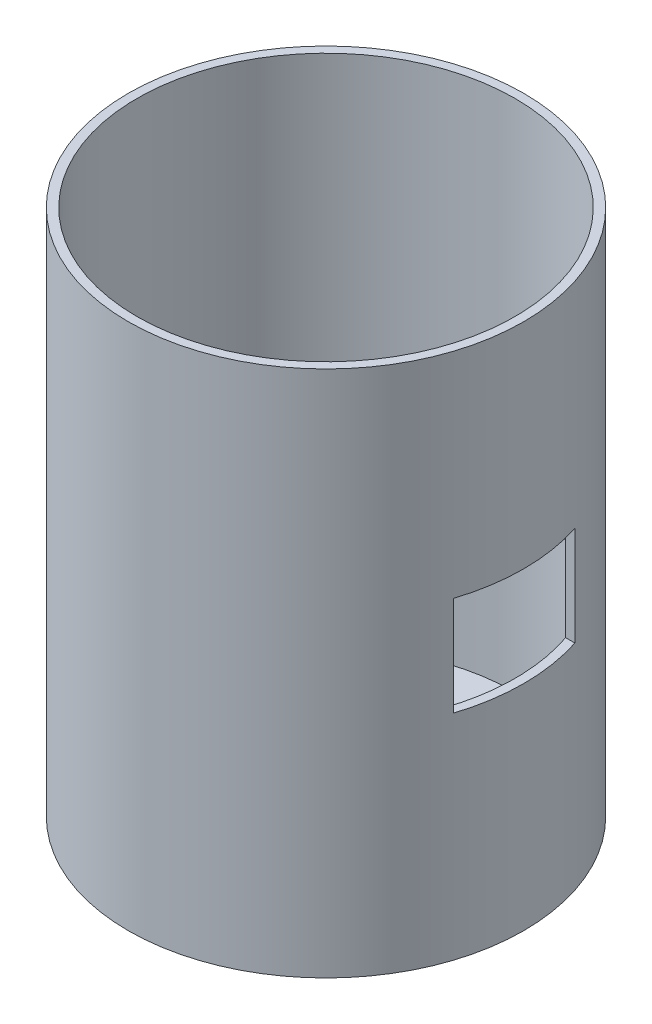
from build123d import *

# Parameters (mm, degrees)
SKETCH1_R            = 45
JAR_BODY_DEPTH       = 120
JAR_INSIDE_START     = 120
SKETCH2_R            = 43
JAR_INSIDE_DEPTH     = 117
TURBIDITY_HOLE_START = 40
SKETCH3_W            = 27.6
SKETCH3_H            = 22.6
TURBIDITY_HOLE_DEPTH = 10


with BuildPart() as part:
    # Sketch1 → Jar_Body (new body)
    with BuildSketch(Plane(origin=(0, 0, 0), x_dir=(1, 0, 0), z_dir=(0, 1, 0))):
        with Locations(Location((0, 0, 0), (0, 0, 270))):
            Circle(SKETCH1_R)
    extrude(amount=JAR_BODY_DEPTH)

    # Sketch2 → Jar_Inside (cut)
    with BuildSketch(Plane(origin=(0, 0, 0), x_dir=(1, 0, 0), z_dir=(0, 1, 0)).offset(JAR_INSIDE_START)):
        with Locations(Location((0, 0, 0), (0, 0, 270))):
            Circle(SKETCH2_R)
    extrude(amount=-JAR_INSIDE_DEPTH, mode=Mode.SUBTRACT)

    # Sketch3 → Turbidity_Hole (cut)
    with BuildSketch(Plane(origin=(0, 0, 0), x_dir=(0, 0, -1), z_dir=(1, 0, 0)).offset(TURBIDITY_HOLE_START)):
        with Locations((0, 60)):
            Rectangle(SKETCH3_W, SKETCH3_H)
    extrude(amount=TURBIDITY_HOLE_DEPTH, mode=Mode.SUBTRACT)


solid = part.part
